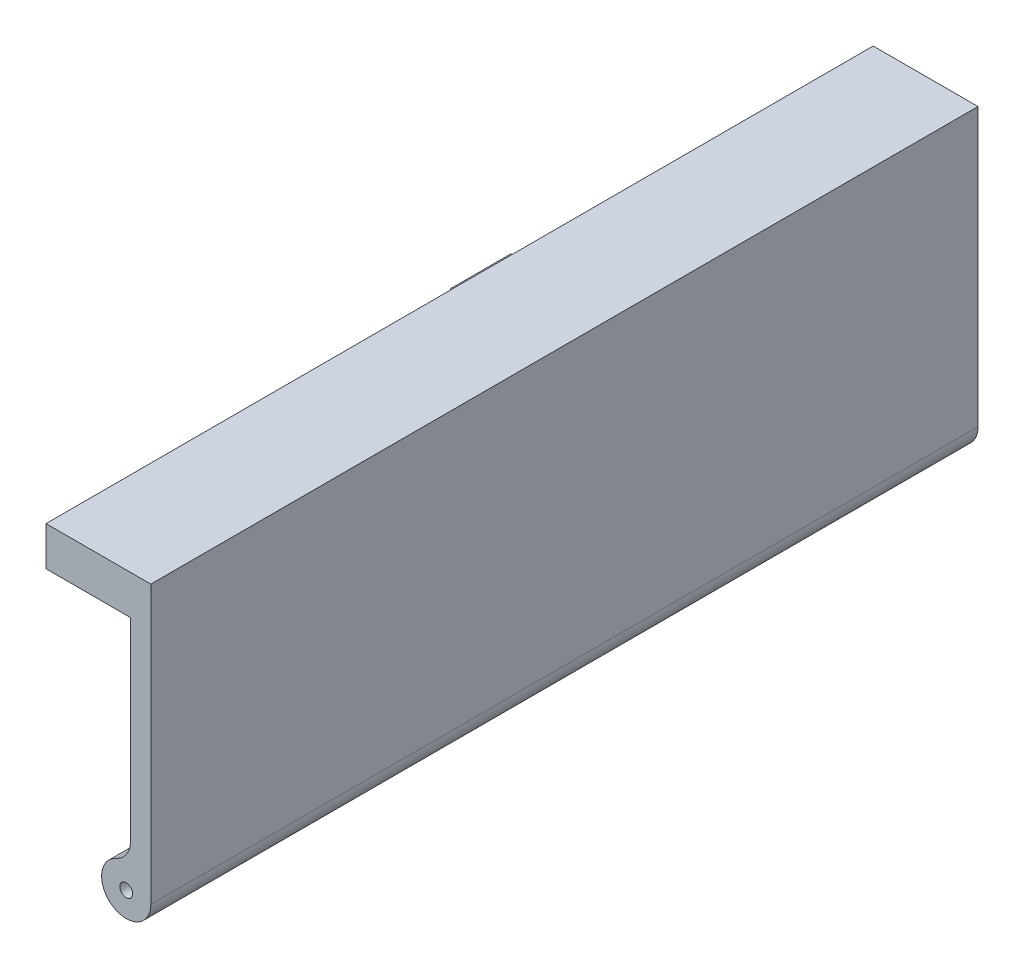
from build123d import *

# Parameters (mm, degrees)
SKETCH1_R           = 0.64
BOSS_EXTRUDE1_DEPTH = 82
SKETCH3_W           = 2
SKETCH3_H           = 82
BOSS_EXTRUDE4_DEPTH = 2.5
SKETCH6_W           = 82
SKETCH6_H           = 3.880734095
BOSS_EXTRUDE5_DEPTH = 8.39
SKETCH27_W          = 6
SKETCH27_H          = 2
BOSS_EXTRUDE6_DEPTH = 2
SKETCH26_W          = 2
SKETCH26_H          = 6
CUT_EXTRUDE2_DEPTH  = 2
CHAMFER1_SIZE       = 0.5


with BuildPart() as part:
    # Sketch1 → Boss-Extrude1 (new body)
    with BuildSketch(Plane.XY):
        with BuildLine():
            Line((2.44, 0), (2.44, 25))
            Line((2.44, 25), (0.44, 25))
            Line((0.44, 25), (0.44, 4.489988864))
            ThreePointArc((0.44, 4.489988864), (0.044314057, 3.140225052), (-1.017489879, 2.217727293))
            ThreePointArc((-1.017489879, 2.217727293), (-1.317369481, -2.05381052), (2.44, 0))
        make_face()
        Circle(SKETCH1_R, mode=Mode.SUBTRACT)
    extrude(amount=BOSS_EXTRUDE1_DEPTH)

    # Sketch3 → Boss-Extrude4 (add)
    with BuildSketch(Plane(origin=(0, 25, 0), x_dir=(1, 0, 0), z_dir=(0, 1, 0))):
        with Locations((1.44, -41)):
            Rectangle(SKETCH3_W, SKETCH3_H)
    extrude(amount=BOSS_EXTRUDE4_DEPTH)

    # Sketch6 → Boss-Extrude5 (add)
    with BuildSketch(Plane.ZY.offset(-0.44)):
        with Locations((41, 25.559632953)):
            Rectangle(SKETCH6_W, SKETCH6_H)
    extrude(amount=BOSS_EXTRUDE5_DEPTH)

    # Sketch27 → Boss-Extrude6 (add)
    with BuildSketch(Plane.ZY.offset(7.95)):
        with Locations((36.92283214, 24.619265905)):
            Rectangle(SKETCH27_W, SKETCH27_H)
    extrude(amount=BOSS_EXTRUDE6_DEPTH)

    # Sketch26 → Cut-Extrude2 (cut)
    with BuildSketch(Plane.XZ.offset(-23.619265905)):
        with Locations((-6.95, 36.92283214)):
            Rectangle(SKETCH26_W, SKETCH26_H)
    extrude(amount=-CUT_EXTRUDE2_DEPTH, mode=Mode.SUBTRACT)


with BuildPart() as cut_extrude2_piece_1:
    # of the separate pieces the step leaves, piece 1, a body of its own (cut_extrude2_pieces)
    add(part.part.solids().sort_by_distance((2.44, 0, 0))[0])


with BuildPart() as cut_extrude2_piece_2:
    # of the separate pieces the step leaves, piece 2, a body of its own (cut_extrude2_pieces)
    add(part.part.solids().sort_by_distance((-9.95, 25.619265905, 39.92283214))[0])

    # Chamfer1
    chamfer1_edges = [cut_extrude2_piece_2.edges().sort_by_distance(p)[0] for p in [
        (-7.95, 23.619265905, 36.92283214),
    ]]
    chamfer(chamfer1_edges, length=CHAMFER1_SIZE)


solid = Compound([cut_extrude2_piece_1.part, cut_extrude2_piece_2.part])
